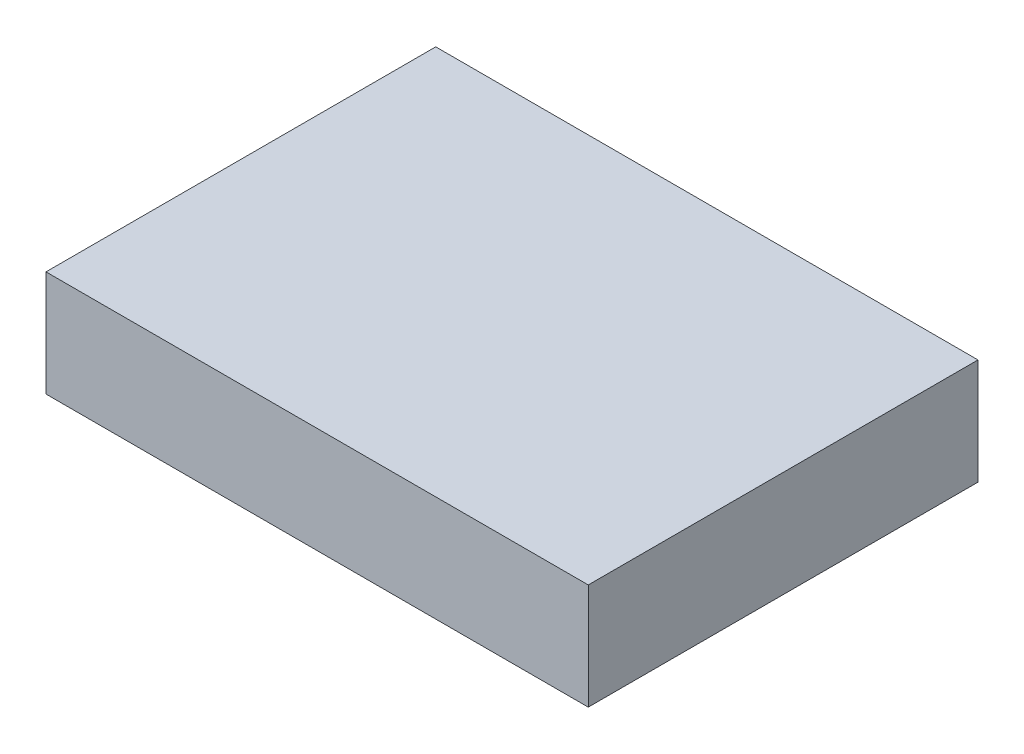
from build123d import *

# Parameters (mm, degrees)
SKETCH_1_W      = 112.7
SKETCH_1_H      = 81
EXTRUDE_1_DEPTH = 22


with BuildPart() as part:
    # 草图1 → 凸台-拉伸1 (new body)
    with BuildSketch(Plane(origin=(0, 0, 0), x_dir=(1, 0, 0), z_dir=(0, 1, 0))):
        Rectangle(SKETCH_1_W, SKETCH_1_H)
    extrude(amount=EXTRUDE_1_DEPTH)


solid = part.part
